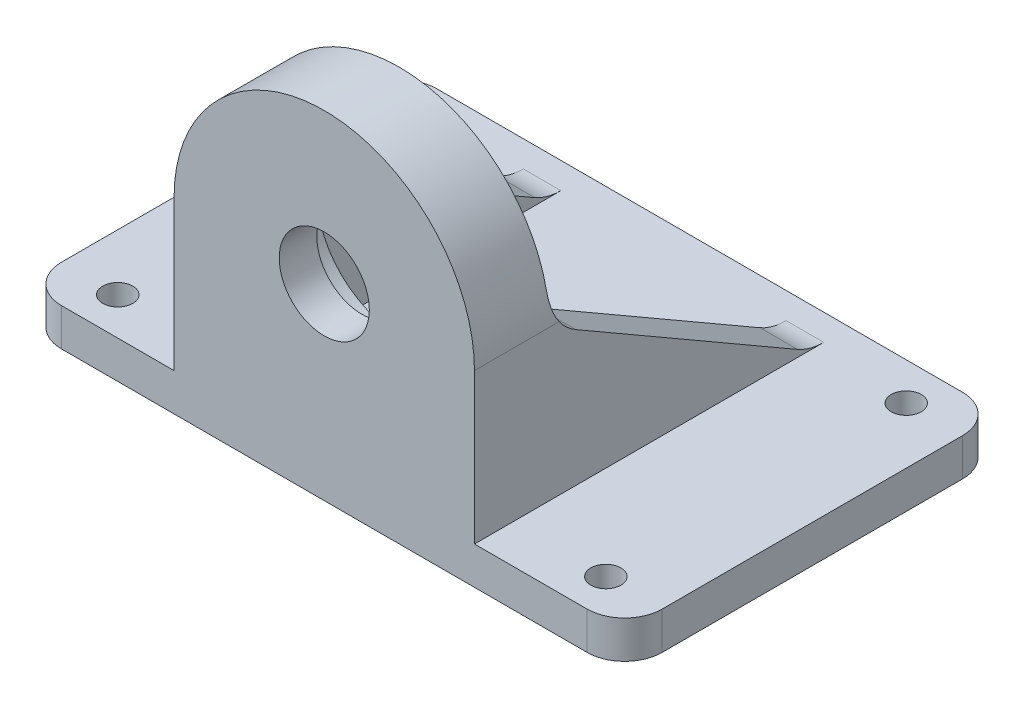
from build123d import *

# Parameters (mm, degrees)
SKETCH1_W           = 80
SKETCH1_H           = 50
BOSS_EXTRUDE1_DEPTH = 5
SKETCH4_R           = 11
BOSS_EXTRUDE2_DEPTH = 10
SKETCH5_R           = 11
SKETCH5_R_2         = 6
BOSS_EXTRUDE3_DEPTH = 5
BOSS_EXTRUDE4_DEPTH = 5
FILLET2_R           = 7
SKETCH7_R           = 2
CUT_EXTRUDE1_DEPTH  = 5
FILLET3_R           = 5


with BuildPart() as part:
    # Sketch1 → Boss-Extrude1 (new body)
    with BuildSketch(Plane(origin=(0, 0, 0), x_dir=(1, 0, 0), z_dir=(0, 1, 0))):
        Rectangle(SKETCH1_W, SKETCH1_H)
    extrude(amount=BOSS_EXTRUDE1_DEPTH)

    # Sketch4 → Boss-Extrude2 (add)
    with BuildSketch(Plane.XY.offset(25)):
        with BuildLine():
            Line((-20, 25), (-20, 5))
            Line((-20, 5), (20, 5))
            Line((20, 5), (20, 25))
            ThreePointArc((20, 25), (0, 45), (-20, 25))
        make_face()
        with Locations((0, 25)):
            Circle(SKETCH4_R, mode=Mode.SUBTRACT)
    extrude(amount=-BOSS_EXTRUDE2_DEPTH)

    # Sketch5 → Boss-Extrude3 (add)
    with BuildSketch(Plane.XY.offset(25)):
        with Locations((0, 25)):
            Circle(SKETCH5_R)
        with Locations((0, 25)):
            Circle(SKETCH5_R_2, mode=Mode.SUBTRACT)
    extrude(amount=-BOSS_EXTRUDE3_DEPTH)

    # Sketch6 → Boss-Extrude4 (add)
    with BuildSketch(Plane.ZY.offset(20)):
        Polygon((15, 25), (-19.641016151, 5), (15, 5), align=None)
    boss_extrude4 = extrude(amount=-BOSS_EXTRUDE4_DEPTH)

    # Mirror1: Boss-Extrude4 across plane
    add(boss_extrude4.mirror(Plane(origin=(0, 0, 0), x_dir=(0, 0, 1), z_dir=(1, 0, 0))))

    # Fillet2
    fillet2_edges = [part.edges().sort_by_distance(p)[0] for p in [
        (0, 5, 15),
        (-17.5, 25, 15),
        (-17.5, 5, -19.641016151),
        (17.5, 25, 15),
        (17.5, 5, -19.641016151),
    ]]
    fillet(fillet2_edges, radius=FILLET2_R)

    # Sketch7 → Cut-Extrude1 (cut)
    with BuildSketch(Plane.XZ):
        with Locations(Location((-32.5, 20, 0), (0, 0, 270))):
            Circle(SKETCH7_R)
        with Locations(Location((-32.5, -20, 0), (0, 0, 270))):
            Circle(SKETCH7_R)
        with Locations(Location((32.5, -20, 0), (0, 0, 270))):
            Circle(SKETCH7_R)
        with Locations(Location((32.5, 20, 0), (0, 0, 270))):
            Circle(SKETCH7_R)
    extrude(amount=-CUT_EXTRUDE1_DEPTH, mode=Mode.SUBTRACT)

    # Fillet3
    fillet3_edges = [part.edges().sort_by_distance(p)[0] for p in [
        (40, 2.5, 25),
        (-40, 2.5, 25),
        (-40, 2.5, -25),
        (40, 2.5, -25),
    ]]
    fillet(fillet3_edges, radius=FILLET3_R)


solid = part.part
